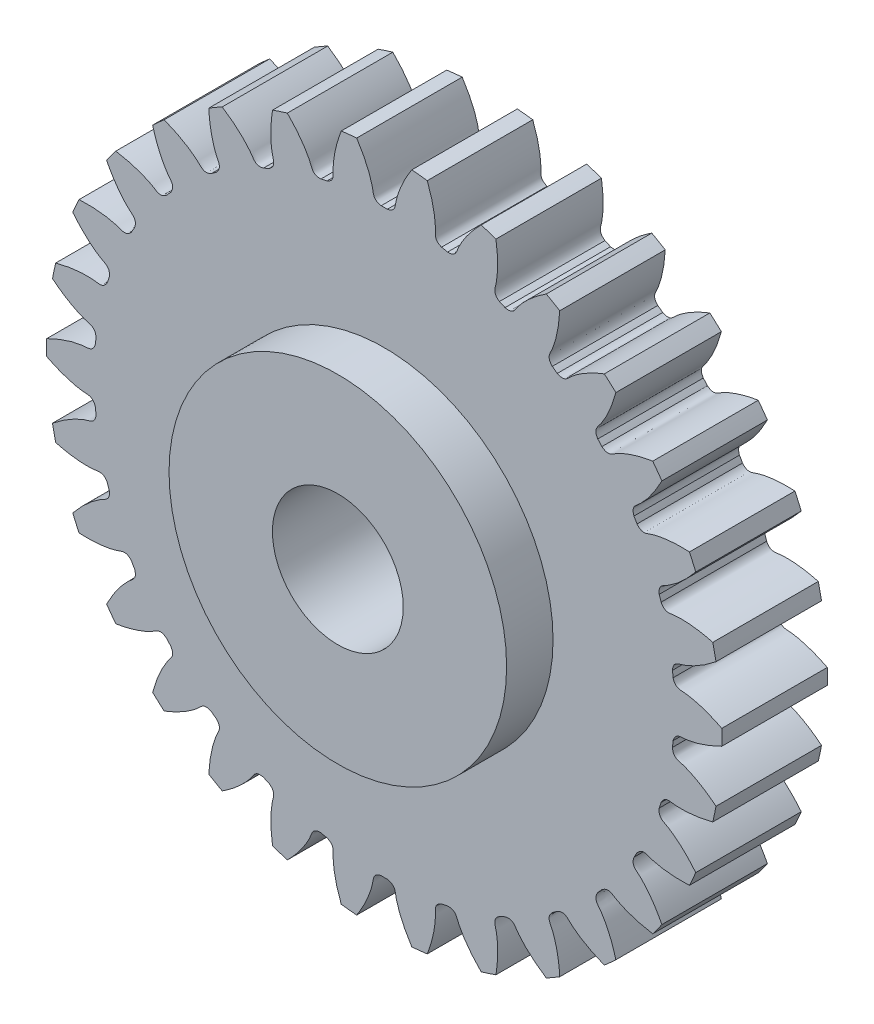
from build123d import *

# Parameters (mm, degrees)
SKETCH_1_R               = 8
EXTRUDE_1_DEPTH          = 2.5
CUT_EXTRUDE_1_DEPTH      = 12.586630226
PATTERN_CIRCULAR_1_COUNT = 30
SKETCH_6_R               = 4
EXTRUDE_3_DEPTH          = 1.1
CUT_EXTRUDE_2_REACH      = 17.455
CUT_EXTRUDE_START        = -3.6


with BuildPart() as part:
    # 草图1 → 凸台-拉伸1 (new body)
    with BuildSketch(Plane.XY):
        Circle(SKETCH_1_R)
    extrude(amount=EXTRUDE_1_DEPTH)

    # 草图2 → 切除-拉伸1 (cut, through all)
    with BuildSketch(Plane.XY):
        with BuildLine():
            ThreePointArc((0.072779314, 6.874614765), (0, 6.875), (-0.072779314, 6.874614765))
            add(Edge.make_bspline(
                [(-0.072779314, 6.874614765), (-0.254115345, 6.906487585), (-0.255152373, 7.023566318), (-0.27949241, 7.144289508), (-0.284975371, 7.169064619), (-0.291623543, 7.196462455), (-0.299533859, 7.226448996), (-0.308815312, 7.258982454), (-0.319571679, 7.294019257), (-0.331906756, 7.331512239), (-0.345922647, 7.37141123), (-0.361720171, 7.413662928), (-0.379398634, 7.458210975), (-0.399055788, 7.504995991), (-0.420787741, 7.553955613), (-0.444688876, 7.605024538), (-0.470851774, 7.658134564), (-0.499367135, 7.713214643), (-0.530323704, 7.770190925), (-0.563808189, 7.828986808), (-0.599905197, 7.889522992), (-0.638697148, 7.951717532), (-0.680264215, 8.015485894), (-0.724684248, 8.080741014), (-0.772032703, 8.147393354), (-0.822382582, 8.215350967), (-0.875804359, 8.284519558), (-0.932365919, 8.354802549), (-0.992132498, 8.426101145), (-1.055166616, 8.498314402), (-1.121528021, 8.571339295), (-1.191273632, 8.645070792), (-1.264457479, 8.719401924), (-1.341130655, 8.794223857), (-1.421341241, 8.869425973), (-1.534461933, 8.971310414), (-1.622672309, 9.046035766), (-1.683155916, 9.095279061)],
                knots=[0, 0, 0, 0, 0.115323882, 0.12341257, 0.132512303, 0.142623081, 0.153744905, 0.165877774, 0.179021689, 0.193176649, 0.208342655, 0.224519706, 0.241707802, 0.259906945, 0.279117132, 0.299338365, 0.320570644, 0.342813968, 0.366068337, 0.390333752, 0.415610213, 0.441897719, 0.46919627, 0.497505867, 0.52682651, 0.557158198, 0.588500931, 0.62085471, 0.654219534, 0.688595404, 0.723982319, 0.76038028, 0.797789286, 0.836209338, 0.875640435, 0.916082578, 1, 1, 1, 1], degree=3))
            ThreePointArc((-1.683155916, 9.095279061), (0, 9.249708917), (1.683155916, 9.095279061))
            add(Edge.make_bspline(
                [(0.072779314, 6.874614765), (0.254115345, 6.906487585), (0.255152373, 7.023566318), (0.27949241, 7.144289508), (0.284975371, 7.169064619), (0.291623543, 7.196462455), (0.299533859, 7.226448996), (0.308815312, 7.258982454), (0.319571679, 7.294019257), (0.331906756, 7.331512239), (0.345922647, 7.37141123), (0.361720171, 7.413662928), (0.379398634, 7.458210975), (0.399055788, 7.504995991), (0.420787741, 7.553955613), (0.444688876, 7.605024538), (0.470851774, 7.658134564), (0.499367135, 7.713214643), (0.530323704, 7.770190925), (0.563808189, 7.828986808), (0.599905197, 7.889522992), (0.638697148, 7.951717532), (0.680264215, 8.015485894), (0.724684248, 8.080741014), (0.772032703, 8.147393354), (0.822382582, 8.215350967), (0.875804359, 8.284519558), (0.932365919, 8.354802549), (0.992132498, 8.426101145), (1.055166616, 8.498314402), (1.121528021, 8.571339295), (1.191273632, 8.645070792), (1.264457479, 8.719401924), (1.341130655, 8.794223857), (1.421341241, 8.869425973), (1.534461933, 8.971310414), (1.622672309, 9.046035766), (1.683155916, 9.095279061)],
                knots=[0, 0, 0, 0, 0.115323882, 0.12341257, 0.132512303, 0.142623081, 0.153744905, 0.165877774, 0.179021689, 0.193176649, 0.208342655, 0.224519706, 0.241707802, 0.259906945, 0.279117132, 0.299338365, 0.320570644, 0.342813968, 0.366068337, 0.390333752, 0.415610213, 0.441897719, 0.46919627, 0.497505867, 0.52682651, 0.557158198, 0.588500931, 0.62085471, 0.654219534, 0.688595404, 0.723982319, 0.76038028, 0.797789286, 0.836209338, 0.875640435, 0.916082578, 1, 1, 1, 1], degree=3))
        make_face()
    cut_extrude_1 = extrude(amount=CUT_EXTRUDE_1_DEPTH, mode=Mode.SUBTRACT)

    # 阵列(圆周)1: 切除-拉伸1 ×30 about axis
    pattern_circular_1_axis = Axis((0, 0, -0.15), (0, 0, 1))
    for i in range(1, PATTERN_CIRCULAR_1_COUNT):
        add(cut_extrude_1.rotate(pattern_circular_1_axis, i * 360 / PATTERN_CIRCULAR_1_COUNT), mode=Mode.SUBTRACT)

    # 草图6 → 凸台-拉伸3 (add)
    with BuildSketch(Plane.XY.offset(2.5)):
        Circle(SKETCH_6_R)
    extrude(amount=EXTRUDE_3_DEPTH)

    # 草图4 → 切除-拉伸2 (cut, up to next)
    with BuildSketch(Plane(origin=(0, 0, 0), x_dir=(-1, 0, 0), z_dir=(0, 0, -1)).offset(CUT_EXTRUDE_START), mode=Mode.PRIVATE) as cut_extrude_2_sk1:
        with BuildLine():
            ThreePointArc((-0.775, 1.342339376), (0, -1.55), (0.775, 1.342339376))
            ThreePointArc((0.775, 1.342339376), (0, 1.55), (-0.775, 1.342339376))
        make_face()
    cut_extrude_2_tool1 = extrude(cut_extrude_2_sk1.sketch, amount=CUT_EXTRUDE_2_REACH, mode=Mode.PRIVATE) & part.part
    add(cut_extrude_2_tool1.solids().sort_by_distance((0, 0, 3.6))[0], mode=Mode.SUBTRACT)


solid = part.part
